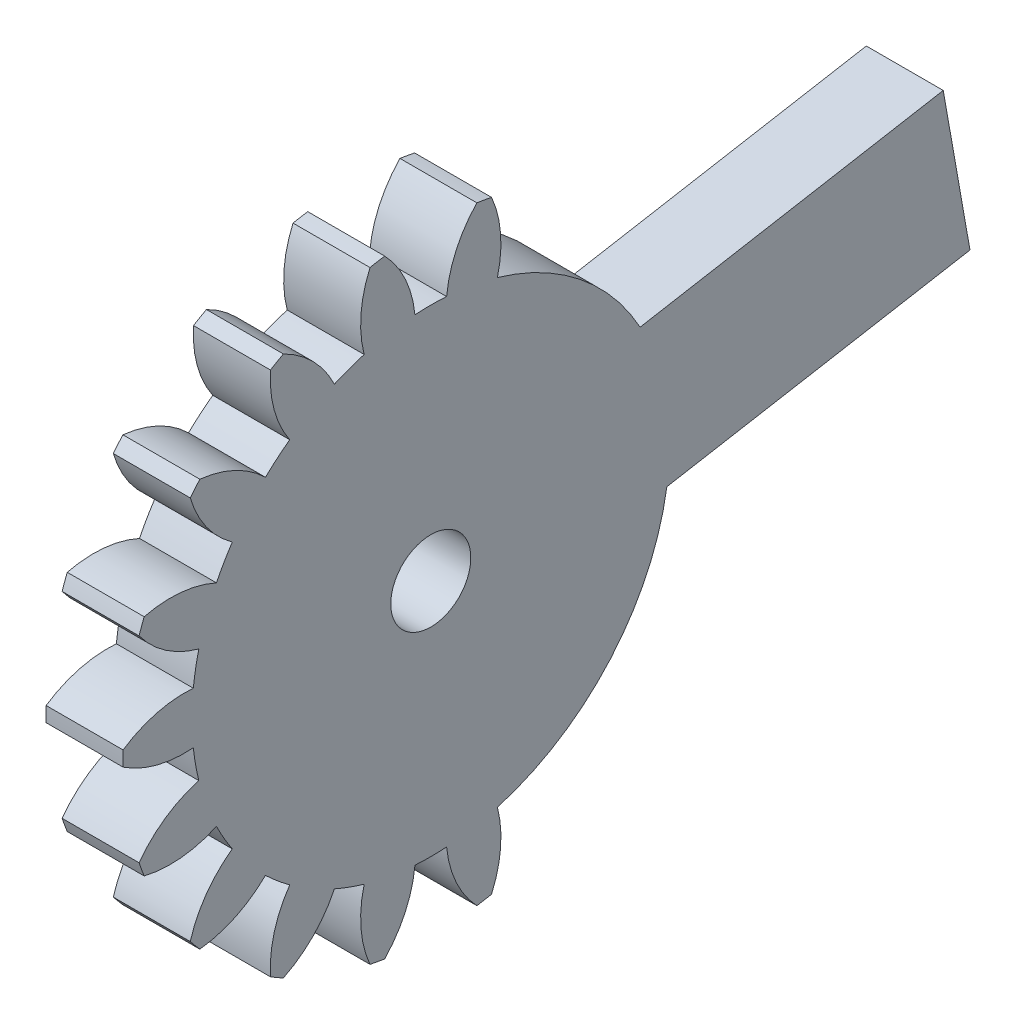
from build123d import *

# Parameters (mm, degrees)
BASPROSKE_W                  = 3.175
BASPROSKE_H                  = 12.7
TOOTHCUT_DEPTH               = 19.238986403
TEETHCUTS_COUNT              = 18
TEETHCUTS_ANGLE              = 340
BORSKE_R                     = 1.5875
BORE_DEPTH                   = 50.8000508
CUT_EXTRUDE_THIN1_DEPTH      = 2.54
CUT_EXTRUDE_THIN1_DEPTH_BACK = 5.08
BOSS_EXTRUDE1_DEPTH          = 3.175
SKETCH9_R                    = 1.651
CUT_EXTRUDE2_DEPTH           = 3.175


with BuildPart() as part:
    # BasProSke → Base-Revolve (revolve)
    with BuildSketch(Plane(origin=(0, 0, 0), x_dir=(1, 0, 0), z_dir=(0, 1, 0)), mode=Mode.PRIVATE) as base_revolve_sk:
        with Locations((1.5875, 6.35)):
            Rectangle(BASPROSKE_W, BASPROSKE_H)
    revolve(base_revolve_sk.sketch.rotate(Axis((-10, 0, 0), (1, 0, 0)), 180), axis=Axis((-10, 0, 0), (1, 0, 0)))

    # TooCutSke → ToothCut (cut, through all)
    with BuildSketch(Plane(origin=(0, 0, 0), x_dir=(0, 0, -1), z_dir=(1, 0, 0))):
        with BuildLine():
            ThreePointArc((0.653663469, 9.833498417), (0, 9.8552), (-0.653663469, 9.833498417))
            ThreePointArc((-0.653663469, 9.833498417), (-1.05484238, 11.314407704), (-1.923354389, 12.579209556))
            ThreePointArc((-1.923354389, 12.579209556), (0, 12.7254), (1.923354389, 12.579209556))
            ThreePointArc((1.923354389, 12.579209556), (1.05484238, 11.314407704), (0.653663469, 9.833498417))
        make_face()
    toothcut = extrude(amount=TOOTHCUT_DEPTH, mode=Mode.SUBTRACT)

    # TeethCuts: ToothCut ×18 about axis
    teethcuts_axis = Axis((-10, 0, 0), (1, 0, 0))
    for i in range(1, TEETHCUTS_COUNT):
        add(toothcut.rotate(teethcuts_axis, i * TEETHCUTS_ANGLE / (TEETHCUTS_COUNT - 1)), mode=Mode.SUBTRACT)

    # BorSke → Bore (cut, symmetric)
    with BuildSketch(Plane(origin=(0, 0, 0), x_dir=(0, 0, -1), z_dir=(1, 0, 0))):
        with Locations(Location((0, 0, 0), (0, 0, 180))):
            Circle(BORSKE_R)
    extrude(amount=BORE_DEPTH, both=True, mode=Mode.SUBTRACT)

    # Sketch7 → Cut-Extrude-Thin1 (cut, two sides: drawn at the far end of the back side and taken through both)
    with BuildSketch(Plane.ZY.offset(-CUT_EXTRUDE_THIN1_DEPTH_BACK)):
        with BuildLine():
            Line((-10.823936545, 10.290898732), (-25.264431922, 12.837147681))
            Line((-25.264431922, 12.837147681), (-28.131363335, -3.422028321))
            Line((-28.131363335, -3.422028321), (-13.690867959, -5.968277271))
            ThreePointArc((-13.690867959, -5.968277271), (-11.782416361, -9.177955314), (-9.137407483, -11.813889433))
            Line((-9.137407483, -11.813889433), (-10.123749891, -15.359323522))
            ThreePointArc((-10.123749891, -15.359323522), (18.392184669, -0.355912967), (-9.521946872, 15.739493597))
            Line((-9.521946872, 15.739493597), (-8.708557038, 12.133475733))
            ThreePointArc((-8.708557038, 12.133475733), (-9.809604931, 11.261964755), (-10.823936545, 10.290898732))
        make_face()
        with BuildLine():
            Line((-8.636682816, 4.746859697), (-21.143741279, 6.952191553))
            Line((-21.143741279, 6.952191553), (-22.246407207, 0.698662322))
            Line((-22.246407207, 0.698662322), (-9.739348744, -1.506669535))
            ThreePointArc((-9.739348744, -1.506669535), (-7.549024322, -6.335392555), (-3.17353646, -9.330253661))
            Line((-3.17353646, -9.330253661), (-4.102105036, -12.668018169))
            ThreePointArc((-4.102105036, -12.668018169), (13.313553301, -0.235050135), (-3.652381497, 12.804923251))
            Line((-3.652381497, 12.804923251), (-2.889344669, 9.422136405))
            ThreePointArc((-2.889344669, 9.422136405), (-6.219073923, 7.64513483), (-8.636682816, 4.746859697))
        make_face(mode=Mode.SUBTRACT)
    extrude(amount=CUT_EXTRUDE_THIN1_DEPTH + CUT_EXTRUDE_THIN1_DEPTH_BACK, mode=Mode.SUBTRACT)

    # Sketch8 → Boss-Extrude1 (add)
    with BuildSketch(Plane.ZY):
        Polygon((-21.143741279, 6.952191553), (-22.246407207, 0.698662322), (-9.739348744, -1.506669535), (-8.636682816, 4.746859697), align=None)
    extrude(amount=-BOSS_EXTRUDE1_DEPTH)

    # Sketch9 → Cut-Extrude2 (cut)
    with BuildSketch(Plane.ZY):
        Circle(SKETCH9_R)
    extrude(amount=-CUT_EXTRUDE2_DEPTH, mode=Mode.SUBTRACT)


solid = part.part
